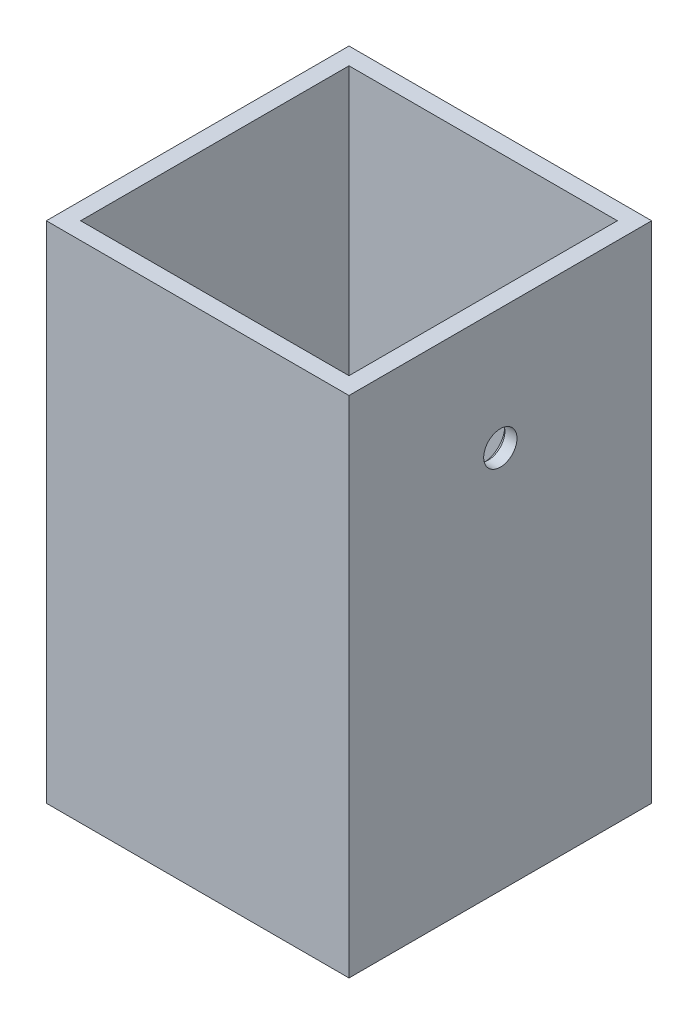
from build123d import *

# Parameters (mm, degrees)
SKETCH1_W           = 30
SKETCH1_H           = 30
BOSS_EXTRUDE1_DEPTH = 50
SHELL1_T            = -1.7
SKETCH2_R           = 1.65
CUT_EXTRUDE1_DEPTH  = 2
SKETCH3_R           = 1.65
CUT_EXTRUDE2_DEPTH  = 2
CHAMFER1_SIZE       = 0.5
CHAMFER2_SIZE       = 0.5


with BuildPart() as part:
    # Sketch1 → Boss-Extrude1 (new body)
    with BuildSketch(Plane(origin=(0, 0, 0), x_dir=(1, 0, 0), z_dir=(0, 1, 0))):
        Rectangle(SKETCH1_W, SKETCH1_H)
    extrude(amount=BOSS_EXTRUDE1_DEPTH)

    # Shell1
    shell1_openings = [part.faces().sort_by_distance(p)[0] for p in [
        (0, 50, 0),
        (0, 0, 0),
    ]]
    offset(amount=SHELL1_T, openings=shell1_openings, kind=Kind.INTERSECTION)

    # Sketch2 → Cut-Extrude1 (cut)
    with BuildSketch(Plane.ZY.offset(15)):
        with Locations((0, 12)):
            Circle(SKETCH2_R)
    extrude(amount=-CUT_EXTRUDE1_DEPTH, mode=Mode.SUBTRACT)

    # Sketch3 → Cut-Extrude2 (cut)
    with BuildSketch(Plane(origin=(15, 0, 0), x_dir=(0, 0, -1), z_dir=(1, 0, 0))):
        with Locations((0, 38)):
            Circle(SKETCH3_R)
    extrude(amount=-CUT_EXTRUDE2_DEPTH, mode=Mode.SUBTRACT)

    # Chamfer1
    chamfer1_edges = [part.edges().sort_by_distance(p)[0] for p in [
        (13.3, 38, 1.65),
    ]]
    chamfer(chamfer1_edges, length=CHAMFER1_SIZE)

    # Chamfer2
    chamfer2_edges = [part.edges().sort_by_distance(p)[0] for p in [
        (-13.3, 12, -1.65),
    ]]
    chamfer(chamfer2_edges, length=CHAMFER2_SIZE)


solid = part.part
